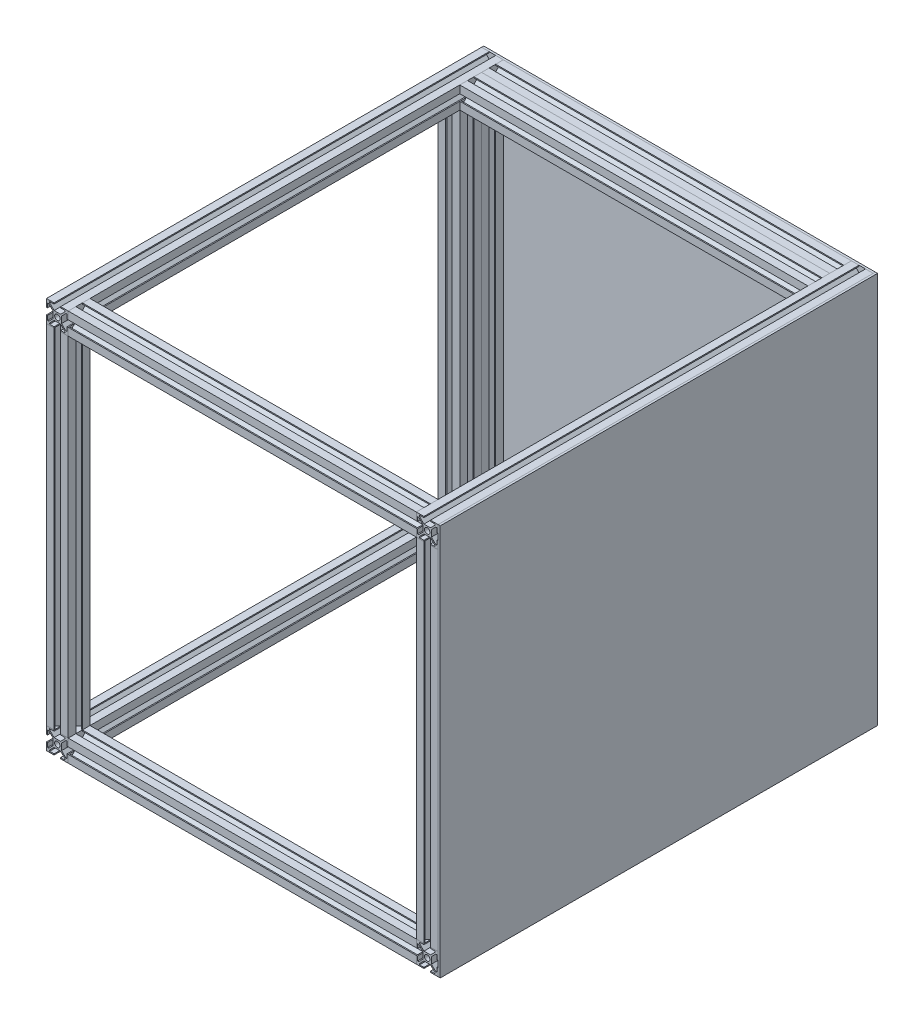
from build123d import *

# Parameters (mm, degrees)
SKETCH2_R                        = 2.5
CIRPATTERN1_COUNT                = 4
SKETCH4_R                        = 2.5
ALUMINIUM_EXTRUSION_PILLAR_DEPTH = 400
CIRPATTERN2_COUNT                = 4
SKETCH5_W                        = 360
SKETCH5_H                        = 360
SKETCH5_R                        = 2.5
BOTTOM_PLATE_DEPTH               = 2
SKETCH6_W                        = 360
SKETCH6_H                        = 402
BACK_PLATE_DEPTH                 = 2


with BuildPart() as part:
    # Aluminium Extrsion Base: sweep along a path in Sketch1
    with BuildLine(Plane(origin=(0, 0, 0), x_dir=(0, 1, 0), z_dir=(0, 0, 1))) as aluminium_extrsion_base_path:
        Line((-160, 160), (-160, -160))
    # Sketch2 → Aluminium Extrsion Base (sweep)
    with BuildSketch(Plane.YZ):
        Polygon((-180, 3), (-180, 10), (-173, 10), (-173, 9), (-177, 9), (-177, 7.985679549), (-173, 3.985679549), (-170, 3.985679549), (-167, 3.985679549), (-163, 7.985679549), (-163, 9), (-167, 9), (-167, 10), (-160, 10), (-160, 3), (-161, 3), (-161, 7), (-162.014320451, 7), (-166.014320451, 3), (-166.014320451, 0), (-166.014320451, -3), (-162.014320451, -7), (-161, -7), (-161, -3), (-160, -3), (-160, -10), (-167, -10), (-167, -9), (-163, -9), (-163, -7.985679549), (-167, -3.985679549), (-170, -3.985679549), (-173, -3.985679549), (-177, -7.985679549), (-177, -9), (-173, -9), (-173, -10), (-180, -10), (-180, -3), (-179, -3), (-179, -7), (-177.985679549, -7), (-173.985679549, -3), (-173.985679549, 0), (-173.985679549, 3), (-177.985679549, 7), (-179, 7), (-179, 3), align=None)
        with Locations((-170, 0)):
            Circle(SKETCH2_R, mode=Mode.SUBTRACT)
    sweep(path=aluminium_extrsion_base_path.line)


with BuildPart() as cirpattern1_1:
    # CirPattern1: pattern copy
    add(part.part.rotate(Axis((0, 0, 0), (0, 0, 1)), 1 * 360 / CIRPATTERN1_COUNT))


with BuildPart() as cirpattern1_2:
    # CirPattern1: pattern copy
    add(part.part.rotate(Axis((0, 0, 0), (0, 0, 1)), 2 * 360 / CIRPATTERN1_COUNT))


with BuildPart() as cirpattern1_3:
    # CirPattern1: pattern copy
    add(part.part.rotate(Axis((0, 0, 0), (0, 0, 1)), 3 * 360 / CIRPATTERN1_COUNT))


with BuildPart() as body_5:
    # Mirror5: mirrored copy
    add(cirpattern1_1.part.mirror(Plane(origin=(-160, 167, 10), x_dir=(1, 0, 0), z_dir=(0, 0, -1))))


with BuildPart() as body_6:
    # Mirror5 2: mirrored copy
    add(part.part.mirror(Plane(origin=(-160, 167, 10), x_dir=(1, 0, 0), z_dir=(0, 0, -1))))


with BuildPart() as body_7:
    # Mirror5 3: mirrored copy
    add(cirpattern1_3.part.mirror(Plane(origin=(-160, 167, 10), x_dir=(1, 0, 0), z_dir=(0, 0, -1))))


with BuildPart() as body_8:
    # Mirror5 4: mirrored copy
    add(cirpattern1_2.part.mirror(Plane(origin=(-160, 167, 10), x_dir=(1, 0, 0), z_dir=(0, 0, -1))))


with BuildPart() as body_9:
    # Sketch4 → Aluminium Extrusion Pillar (new body)
    with BuildSketch(Plane(origin=(0, 0, -10), x_dir=(0, 1, 0), z_dir=(0, 0, 1))):
        Polygon((-180, -167), (-180, -160), (-173, -160), (-173, -161), (-177, -161), (-177, -162.089574502), (-173, -166.089574502), (-170, -166.089574502), (-167, -166.089574502), (-163, -162.089574502), (-163, -161), (-167, -161), (-167, -160), (-160, -160), (-160, -167), (-161, -167), (-161, -163), (-162.089574502, -163), (-166.089574502, -167), (-166.089574502, -170), (-166.089574502, -173), (-162.089574502, -177), (-161, -177), (-161, -173), (-160, -173), (-160, -180), (-167, -180), (-167, -179), (-163, -179), (-163, -177.910425498), (-167, -173.910425498), (-170, -173.910425498), (-173, -173.910425498), (-177, -177.910425498), (-177, -179), (-173, -179), (-173, -180), (-180, -180), (-180, -173), (-179, -173), (-179, -177), (-177.910425498, -177), (-173.910425498, -173), (-173.910425498, -170), (-173.910425498, -167), (-177.910425498, -163), (-179, -163), (-179, -167), align=None)
        with Locations((-170, -170)):
            Circle(SKETCH4_R, mode=Mode.SUBTRACT)
    extrude(amount=ALUMINIUM_EXTRUSION_PILLAR_DEPTH)


with BuildPart() as cirpattern2_1:
    # CirPattern2: pattern copy
    add(body_9.part.rotate(Axis((0, 0, 0), (0, 0, 1)), 1 * 360 / CIRPATTERN2_COUNT))


with BuildPart() as cirpattern2_2:
    # CirPattern2: pattern copy
    add(body_9.part.rotate(Axis((0, 0, 0), (0, 0, 1)), 2 * 360 / CIRPATTERN2_COUNT))


with BuildPart() as cirpattern2_3:
    # CirPattern2: pattern copy
    add(body_9.part.rotate(Axis((0, 0, 0), (0, 0, 1)), 3 * 360 / CIRPATTERN2_COUNT))


with BuildPart() as body_13:
    # Mirror4: mirrored copy
    add(cirpattern1_3.part.mirror(Plane.XY.offset(190)))


with BuildPart() as body_14:
    # Mirror4 2: mirrored copy
    add(part.part.mirror(Plane.XY.offset(190)))


with BuildPart() as body_15:
    # Mirror4 3: mirrored copy
    add(cirpattern1_1.part.mirror(Plane.XY.offset(190)))


with BuildPart() as body_16:
    # Mirror4 4: mirrored copy
    add(cirpattern1_2.part.mirror(Plane.XY.offset(190)))


with BuildPart() as body_17:
    # Sketch5 → Bottom Plate (new body)
    with BuildSketch(Plane(origin=(0, 0, -10), x_dir=(1, 0, 0), z_dir=(0, 0, -1))):
        Rectangle(SKETCH5_W, SKETCH5_H)
        with Locations((-170, -170)):
            Circle(SKETCH5_R, mode=Mode.SUBTRACT)
        with Locations((170, -170)):
            Circle(SKETCH5_R, mode=Mode.SUBTRACT)
        with Locations((170, 170)):
            Circle(SKETCH5_R, mode=Mode.SUBTRACT)
        with Locations((-170, 170)):
            Circle(SKETCH5_R, mode=Mode.SUBTRACT)
    extrude(amount=BOTTOM_PLATE_DEPTH)


with BuildPart() as body_18:
    # Sketch6 → Back Plate (new body)
    with BuildSketch(Plane.YZ.offset(180)):
        with Locations((0, 189)):
            Rectangle(SKETCH6_W, SKETCH6_H)
    extrude(amount=BACK_PLATE_DEPTH)


solid = Compound([part.part, cirpattern1_1.part, cirpattern1_2.part, cirpattern1_3.part, body_5.part, body_6.part, body_7.part, body_8.part, body_9.part, cirpattern2_1.part, cirpattern2_2.part, cirpattern2_3.part, body_13.part, body_14.part, body_15.part, body_16.part, body_17.part, body_18.part])
